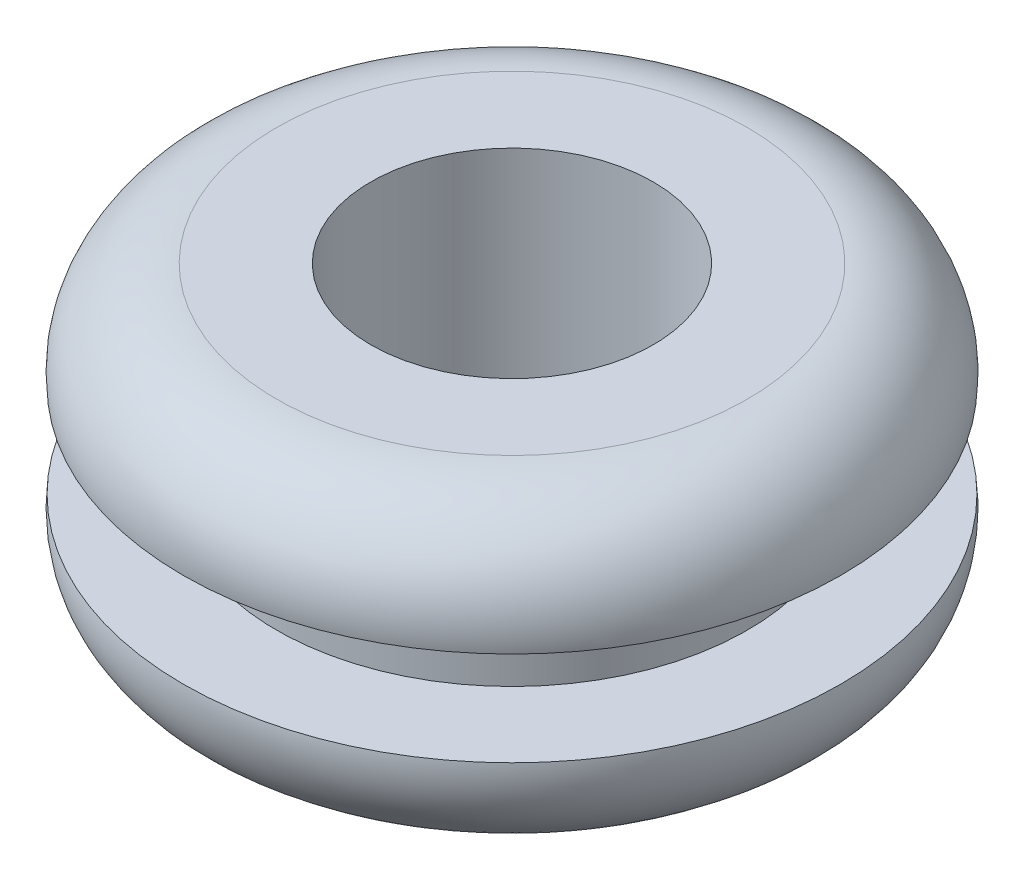
from build123d import *


with BuildPart() as part:
    # Sketch2 → Revolve1 (revolve)
    with BuildSketch(Plane(origin=(0, 0, 0), x_dir=(0, 0, -1), z_dir=(1, 0, 0)), mode=Mode.PRIVATE) as revolve1_sk:
        with BuildLine():
            Line((-4.7625, -5.159375), (-4.7625, 5.159375))
            Line((-4.7625, 5.159375), (-7.9375, 5.159375))
            ThreePointArc((-7.9375, 5.159375), (-10.31875, 4.084440103), (-11.087597655, 1.5875))
            Line((-11.087597655, 1.5875), (-7.9375, 1.5875))
            Line((-7.9375, 1.5875), (-7.9375, -1.5875))
            Line((-7.9375, -1.5875), (-11.087597655, -1.5875))
            ThreePointArc((-11.087597655, -1.5875), (-10.31875, -4.084440103), (-7.9375, -5.159375))
            Line((-7.9375, -5.159375), (-4.7625, -5.159375))
        make_face()
    revolve(revolve1_sk.sketch.rotate(Axis((0, -5.159375, 0), (0, 1, 0)), 180), axis=Axis((0, -5.159375, 0), (0, 1, 0)))


solid = part.part
